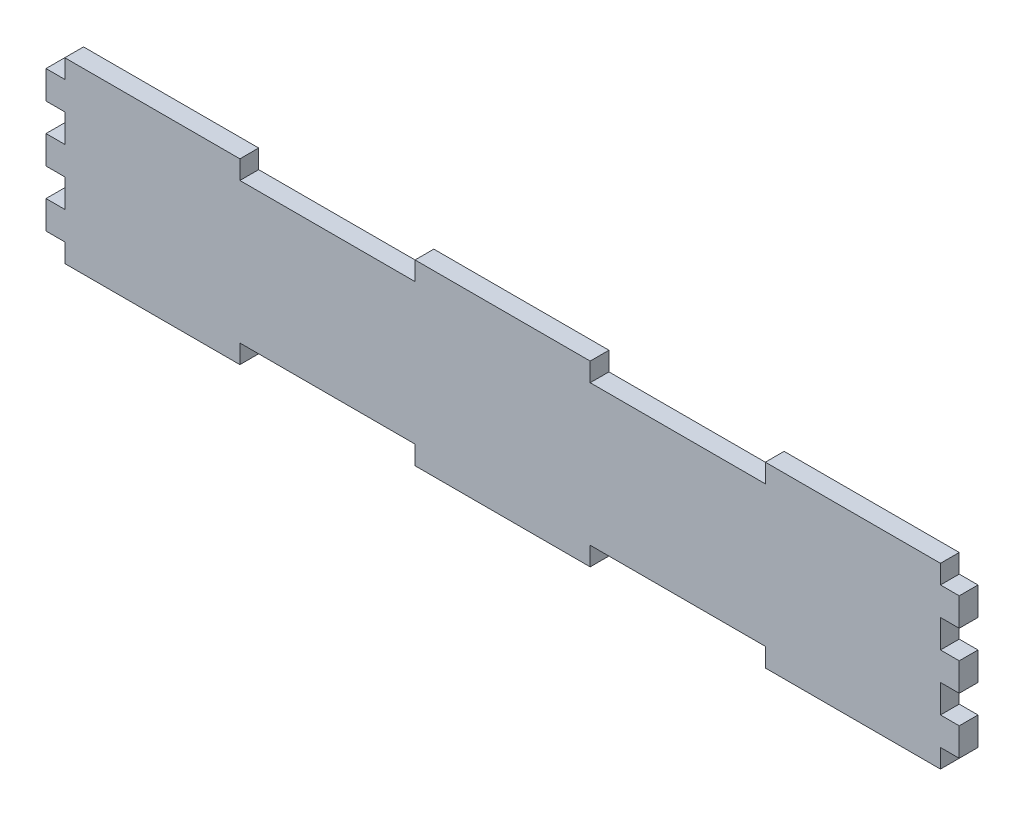
from build123d import *

# Parameters (mm, degrees)
BOSS_EXTRUDE1_DEPTH = 3


with BuildPart() as part:
    # Sketch1 → Boss-Extrude1 (new body)
    with BuildSketch(Plane.XY):
        Polygon((-59.804347826, 30.706521739), (-59.804347826, 33.706521739), (-31.804347826, 33.706521739), (-31.804347826, 30.706521739), (-3.804347826, 30.706521739), (-3.804347826, 33.706521739), (24.195652174, 33.706521739), (24.195652174, 30.706521739), (52.195652174, 30.706521739), (52.195652174, 33.706521739), (80.195652174, 33.706521739), (80.195652174, 30.706521739), (83.195652174, 30.706521739), (83.195652174, 26.206521739), (80.195652174, 26.206521739), (80.195652174, 21.706521739), (83.195652174, 21.706521739), (83.195652174, 17.206521739), (80.195652174, 17.206521739), (80.195652174, 12.706521739), (83.195652174, 12.706521739), (83.195652174, 8.206521739), (80.195652174, 8.206521739), (80.195652174, 5.206521739), (52.195652174, 5.206521739), (52.195652174, 8.206521739), (24.195652174, 8.206521739), (24.195652174, 5.206521739), (-3.804347826, 5.206521739), (-3.804347826, 8.206521739), (-31.804347826, 8.206521739), (-31.804347826, 5.206521739), (-59.804347826, 5.206521739), (-59.804347826, 8.206521739), (-62.804347826, 8.206521739), (-62.804347826, 12.706521739), (-59.804347826, 12.706521739), (-59.804347826, 17.206521739), (-62.804347826, 17.206521739), (-62.804347826, 21.706521739), (-59.804347826, 21.706521739), (-59.804347826, 26.206521739), (-62.804347826, 26.206521739), (-62.804347826, 30.706521739), align=None)
    extrude(amount=BOSS_EXTRUDE1_DEPTH)


solid = part.part
